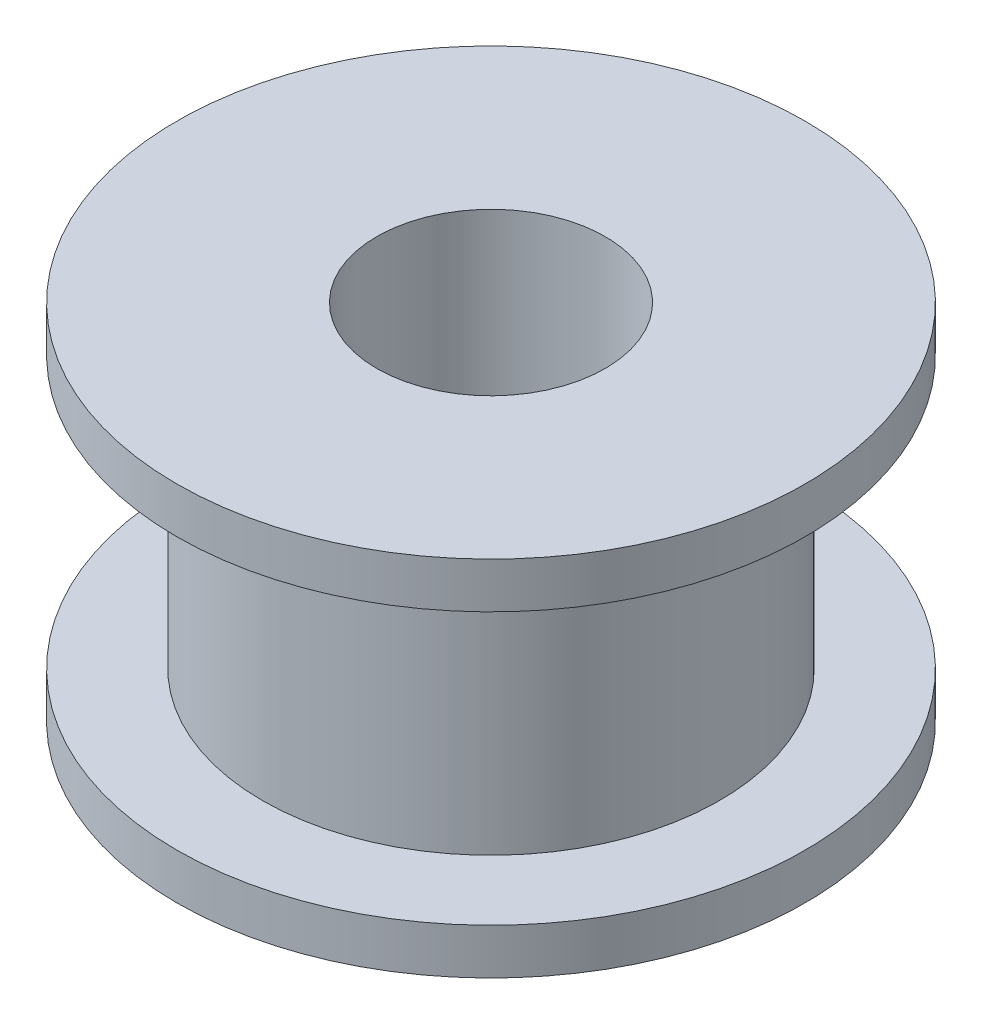
from build123d import *

# Parameters (mm, degrees)
SKETCH1_R               = 11
BOSS_EXTRUDE1_DEPTH     = 1.6
SKETCH2_R               = 8
BOSS_EXTRUDE2_DEPTH     = 9.5
SKETCH3_R               = 11
BOSS_EXTRUDE3_DEPTH     = 1.6
CUT_EXTRUDE1_DEPTH      = 21.082081565
CUT_EXTRUDE1_DEPTH_BACK = 21.082081565
SKETCH4_R               = 4


with BuildPart() as part:
    # Sketch1 → Boss-Extrude1 (new body)
    with BuildSketch(Plane(origin=(0, 0, 0), x_dir=(1, 0, 0), z_dir=(0, 1, 0))):
        with Locations(Location((0, 0, 0), (0, 0, 270))):
            Circle(SKETCH1_R)
    extrude(amount=BOSS_EXTRUDE1_DEPTH)

    # Sketch2 → Boss-Extrude2 (add)
    with BuildSketch(Plane(origin=(0, 1.6, 0), x_dir=(1, 0, 0), z_dir=(0, 1, 0))):
        with Locations(Location((0, 0, 0), (0, 0, 270))):
            Circle(SKETCH2_R)
    extrude(amount=BOSS_EXTRUDE2_DEPTH)

    # Sketch3 → Boss-Extrude3 (add)
    with BuildSketch(Plane(origin=(0, 11.1, 0), x_dir=(1, 0, 0), z_dir=(0, 1, 0))):
        with Locations(Location((0, 0, 0), (0, 0, 270))):
            Circle(SKETCH3_R)
    extrude(amount=BOSS_EXTRUDE3_DEPTH)

    # Sketch4 → Cut-Extrude1 (cut, two sides: drawn at the far end of the back side and taken through both)
    with BuildSketch(Plane(origin=(0, 12.7, 0), x_dir=(1, 0, 0), z_dir=(0, 1, 0)).offset(-CUT_EXTRUDE1_DEPTH_BACK)):
        with Locations(Location((0, 0, 0), (0, 0, 270))):
            Circle(SKETCH4_R)
    extrude(amount=CUT_EXTRUDE1_DEPTH + CUT_EXTRUDE1_DEPTH_BACK, mode=Mode.SUBTRACT)


solid = part.part
